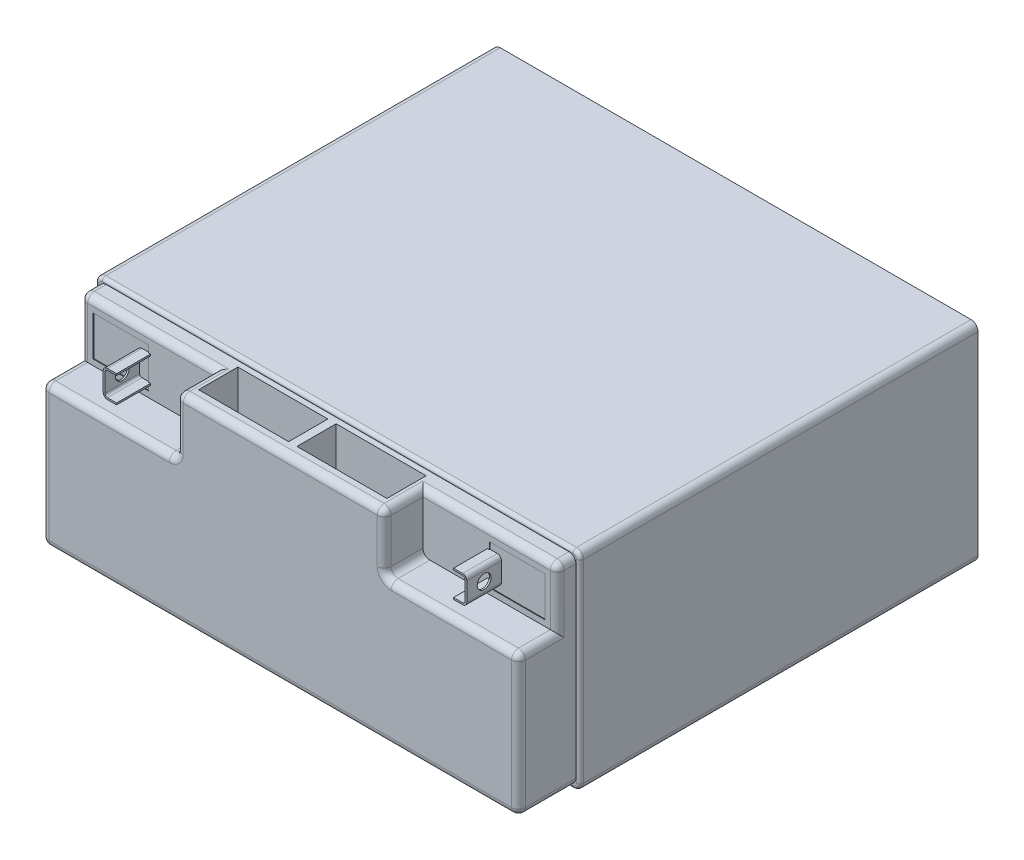
from build123d import *

# Parameters (mm, degrees)
SKETCH1_W           = 177.8
SKETCH1_H           = 146.05
BOSS_EXTRUDE1_DEPTH = 76.2
SKETCH2_W           = 174.845239449
SKETCH2_H           = 73.245239449
BOSS_EXTRUDE2_DEPTH = 21.082
SKETCH3_W           = 49.276
SKETCH3_H           = 21.336
CUT_EXTRUDE1_DEPTH  = 14.224
CUT_EXTRUDE2_DEPTH  = 0.254
SKETCH5_W           = 4.899959439
SKETCH5_H           = 9.93235002
BOSS_EXTRUDE3_DEPTH = 12.446
SKETCH6_W           = 12.446
SKETCH6_H           = 8.710518868
CUT_EXTRUDE3_DEPTH  = 4.289043863
SKETCH7_W           = 3.519901011
SKETCH7_H           = 8.710518868
CUT_EXTRUDE4_DEPTH  = 0.254
SKETCH8_W           = 49.276
SKETCH8_H           = 14.224
CUT_EXTRUDE5_DEPTH  = 21.336
CUT_EXTRUDE6_DEPTH  = 0.254
SKETCH10_W          = 4.899959439
SKETCH10_H          = 9.93235002
BOSS_EXTRUDE4_DEPTH = 12.446
SKETCH11_W          = 12.446
SKETCH11_H          = 8.710518868
CUT_EXTRUDE7_DEPTH  = 4.289043863
SKETCH12_W          = 3.519901012
SKETCH12_H          = 8.710518868
CUT_EXTRUDE8_DEPTH  = 0.254
SKETCH13_W          = 63.5
SKETCH13_H          = 15.201284342
CUT_EXTRUDE9_DEPTH  = 19.558
SKETCH14_W          = 63.5
SKETCH14_H          = 15.201284342
CUT_EXTRUDE10_DEPTH = 19.558
SKETCH15_W          = 33.02
SKETCH15_H          = 14.399652357
CUT_EXTRUDE11_DEPTH = 19.05
SKETCH16_W          = 33.02
SKETCH16_H          = 14.399652357
CUT_EXTRUDE12_DEPTH = 19.05
HOLE1_D             = 5.08
HOLE1_DEPTH         = 0.610915576
HOLE2_D             = 5.08
HOLE2_DEPTH         = 0.610915576
FILLET1_R           = 2.54
FILLET2_R           = 0.913084424
FILLET3_R           = 1.27
FILLET4_R           = 1.524


with BuildPart() as part:
    # Sketch1 → Boss-Extrude1 (new body)
    with BuildSketch(Plane.XZ.offset(62.213215728)):
        with Locations((55.786931477, 73.025)):
            Rectangle(SKETCH1_W, SKETCH1_H)
    extrude(amount=-BOSS_EXTRUDE1_DEPTH)

    # Sketch2 → Boss-Extrude2 (add)
    with BuildSketch(Plane.XY.offset(146.05)):
        with Locations((55.786931477, -24.113215728)):
            Rectangle(SKETCH2_W, SKETCH2_H)
    extrude(amount=BOSS_EXTRUDE2_DEPTH)

    # Sketch3 → Cut-Extrude1 (cut)
    with BuildSketch(Plane.XY.offset(167.132)):
        with Locations((-6.997688247, 1.841403997)):
            Rectangle(SKETCH3_W, SKETCH3_H)
    extrude(amount=-CUT_EXTRUDE1_DEPTH, mode=Mode.SUBTRACT)

    # Sketch4 → Cut-Extrude2 (cut)
    with BuildSketch(Plane.XY.offset(152.908)):
        Polygon((-6.787176985, 5.394931697), (-6.787176985, 7.942830943), (-27.07261505, 7.942830943), (-27.07261505, -6.677584717), (-6.787176985, -6.677584717), (-6.787176985, -4.537418323), (-10.917993572, -4.537418323), (-10.917993572, 5.394931697), align=None)
    extrude(amount=-CUT_EXTRUDE2_DEPTH, mode=Mode.SUBTRACT)

    # Sketch5 → Boss-Extrude3 (add)
    with BuildSketch(Plane.XY.offset(152.908)):
        with Locations((-8.468013853, 0.428756687)):
            Rectangle(SKETCH5_W, SKETCH5_H)
    extrude(amount=BOSS_EXTRUDE3_DEPTH)

    # Sketch6 → Cut-Extrude3 (cut)
    with BuildSketch(Plane(origin=(-6.018034133, 0, 0), x_dir=(0, 0, -1), z_dir=(1, 0, 0))):
        with Locations((-159.131, 0.428756687)):
            Rectangle(SKETCH6_W, SKETCH6_H)
    extrude(amount=-CUT_EXTRUDE3_DEPTH, mode=Mode.SUBTRACT)

    # Sketch7 → Cut-Extrude4 (cut)
    with BuildSketch(Plane.XY.offset(152.908)):
        with Locations((-8.54712749, 0.428756687)):
            Rectangle(SKETCH7_W, SKETCH7_H)
    extrude(amount=-CUT_EXTRUDE4_DEPTH, mode=Mode.SUBTRACT)

    # Sketch8 → Cut-Extrude5 (cut)
    with BuildSketch(Plane(origin=(0, 12.509403997, 0), x_dir=(-1, 0, 0), z_dir=(0, 1, 0))):
        with Locations((-118.571551202, 160.02)):
            Rectangle(SKETCH8_W, SKETCH8_H)
    extrude(amount=-CUT_EXTRUDE5_DEPTH, mode=Mode.SUBTRACT)

    # Sketch9 → Cut-Extrude6 (cut)
    with BuildSketch(Plane.XY.offset(152.908)):
        Polygon((118.361039939, 7.942830943), (118.361039939, 5.394931697), (122.491856526, 5.394931697), (122.491856526, -4.537418323), (118.361039939, -4.537418323), (118.361039939, -6.677584717), (138.646478004, -6.677584717), (138.646478004, 7.942830943), align=None)
    extrude(amount=-CUT_EXTRUDE6_DEPTH, mode=Mode.SUBTRACT)

    # Sketch10 → Boss-Extrude4 (add)
    with BuildSketch(Plane.XY.offset(152.908)):
        with Locations((120.041876806, 0.428756687)):
            Rectangle(SKETCH10_W, SKETCH10_H)
    extrude(amount=BOSS_EXTRUDE4_DEPTH)

    # Sketch11 → Cut-Extrude7 (cut)
    with BuildSketch(Plane.ZY.offset(-117.591897087)):
        with Locations((159.131, 0.428756687)):
            Rectangle(SKETCH11_W, SKETCH11_H)
    extrude(amount=-CUT_EXTRUDE7_DEPTH, mode=Mode.SUBTRACT)

    # Sketch12 → Cut-Extrude8 (cut)
    with BuildSketch(Plane.XY.offset(152.908)):
        with Locations((120.120990445, 0.428756687)):
            Rectangle(SKETCH12_W, SKETCH12_H)
    extrude(amount=-CUT_EXTRUDE8_DEPTH, mode=Mode.SUBTRACT)

    # Sketch13 → Cut-Extrude9 (cut)
    with BuildSketch(Plane.XZ.offset(60.735835452)):
        with Locations((22.974311753, 155.2427389)):
            Rectangle(SKETCH13_W, SKETCH13_H)
    extrude(amount=-CUT_EXTRUDE9_DEPTH, mode=Mode.SUBTRACT)

    # Sketch14 → Cut-Extrude10 (cut)
    with BuildSketch(Plane.XZ.offset(60.735835452)):
        with Locations((88.599551202, 155.2427389)):
            Rectangle(SKETCH14_W, SKETCH14_H)
    extrude(amount=-CUT_EXTRUDE10_DEPTH, mode=Mode.SUBTRACT)

    # Sketch15 → Cut-Extrude11 (cut)
    with BuildSketch(Plane(origin=(0, 12.509403997, 0), x_dir=(-1, 0, 0), z_dir=(0, 1, 0))):
        with Locations((-37.752931477, 155.313650768)):
            Rectangle(SKETCH15_W, SKETCH15_H)
    extrude(amount=-CUT_EXTRUDE11_DEPTH, mode=Mode.SUBTRACT)

    # Sketch16 → Cut-Extrude12 (cut)
    with BuildSketch(Plane(origin=(0, 12.509403997, 0), x_dir=(-1, 0, 0), z_dir=(0, 1, 0))):
        with Locations((-73.820931477, 155.313650768)):
            Rectangle(SKETCH16_W, SKETCH16_H)
    extrude(amount=-CUT_EXTRUDE12_DEPTH, mode=Mode.SUBTRACT)

    # Hole1
    with Locations(Plane(origin=(122.491856526, 0, 0), x_dir=(0, 0, -1), z_dir=(1, 0, 0))):
        with Locations((-159.004, 0.428756687)):
            Hole(HOLE1_D / 2, depth=HOLE1_DEPTH)

    # Hole2
    with Locations(Plane.ZY.offset(10.917993572)):
        with Locations((159.004, 0.428756687)):
            Hole(HOLE2_D / 2, depth=HOLE2_DEPTH)

    # Fillet1
    fillet1_edges = [part.edges().sort_by_distance(p)[0] for p in [
        (144.686931477, 13.986784272, 73.025),
        (55.786931477, 12.509403997, 167.132),
        (143.209551202, 12.509403997, 149.479),
        (143.209551202, -8.826596003, 160.02),
        (143.209551202, 1.841403997, 152.908),
        (118.571551202, -8.826596003, 167.132),
        (93.933551202, -8.826596003, 160.02),
        (93.933551202, 1.841403997, 167.132),
        (118.571551202, 12.509403997, 152.908),
        (93.933551202, 12.509403997, 160.02),
        (-31.635688247, -60.735835452, 156.591),
        (143.209551202, -60.735835452, 156.591),
        (55.786931477, -60.735835452, 167.132),
        (143.209551202, -34.781215728, 167.132),
        (-31.635688247, -34.781215728, 167.132),
        (-31.635688247, 12.509403997, 149.479),
        (-6.997688247, 12.509403997, 152.908),
        (17.640311753, 12.509403997, 160.02),
        (17.640311753, -8.826596003, 160.02),
        (-31.635688247, 1.841403997, 152.908),
        (-31.635688247, -8.826596003, 160.02),
        (-6.997688247, -8.826596003, 167.132),
        (17.640311753, 1.841403997, 167.132),
        (-33.113068523, 13.986784272, 73.025),
        (144.686931477, -62.213215728, 73.025),
        (-33.113068523, -62.213215728, 73.025),
    ]]
    fillet(fillet1_edges, radius=FILLET1_R)

    # Fillet2
    fillet2_edges = [part.edges().sort_by_distance(p)[0] for p in [
        (121.880940951, 4.784016121, 159.004),
        (121.880940951, -3.926502747, 159.004),
        (-10.307077996, -3.926502747, 159.004),
        (-10.307077996, 4.784016121, 159.004),
    ]]
    fillet(fillet2_edges, radius=FILLET2_R)

    # Fillet3
    fillet3_edges = [part.edges().sort_by_distance(p)[0] for p in [
        (144.686931477, -24.113215728, 146.05),
        (55.786931477, -62.213215728, 146.05),
        (55.786931477, 13.986784272, 146.05),
        (-33.113068523, -24.113215728, 146.05),
        (-32.369119747, 13.242835496, 146.05),
        (143.942982701, -61.469266952, 146.05),
        (-32.369119747, -61.469266952, 146.05),
        (143.942982701, 13.242835496, 146.05),
    ]]
    fillet(fillet3_edges, radius=FILLET3_R)

    # Fillet4
    fillet4_edges = [part.edges().sort_by_distance(p)[0] for p in [
        (122.491856526, -4.537418323, 159.004),
        (122.491856526, 5.394931697, 159.004),
        (-10.917993572, 5.394931697, 159.004),
        (-10.917993572, -4.537418323, 159.004),
    ]]
    fillet(fillet4_edges, radius=FILLET4_R)


solid = part.part
